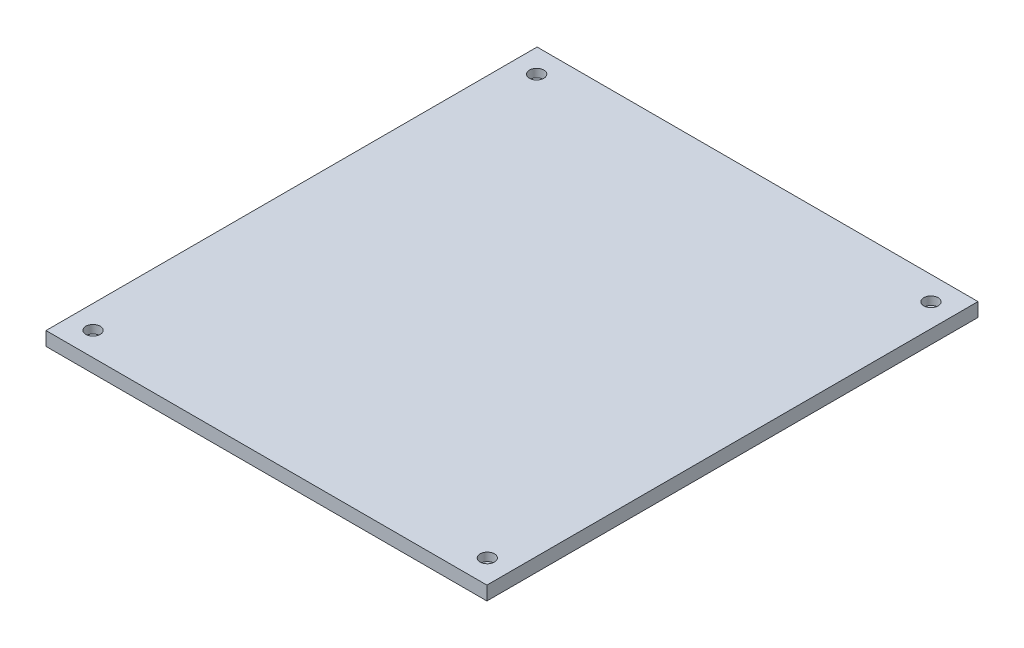
from build123d import *

# Parameters (mm, degrees)
SKETCH1_W           = 160
SKETCH1_H           = 178.21
SKETCH1_R           = 1.5
BOSS_EXTRUDE2_DEPTH = 5
SKETCH2_R           = 2.6
CUT_EXTRUDE1_DEPTH  = 3


with BuildPart() as part:
    # Sketch1 → Boss-Extrude2 (new body)
    with BuildSketch(Plane(origin=(0, 0, 0), x_dir=(1, 0, 0), z_dir=(0, 1, 0))):
        Rectangle(SKETCH1_W, SKETCH1_H)
        with Locations(Location((-71.538779571, 80.496682783, 0), (0, 0, 270))):
            Circle(SKETCH1_R, mode=Mode.SUBTRACT)
        with Locations(Location((71.538779571, 80.496682783, 0), (0, 0, 270))):
            Circle(SKETCH1_R, mode=Mode.SUBTRACT)
        with Locations(Location((71.538779571, -80.496682783, 0), (0, 0, 270))):
            Circle(SKETCH1_R, mode=Mode.SUBTRACT)
        with Locations(Location((-71.538779571, -80.496682783, 0), (0, 0, 270))):
            Circle(SKETCH1_R, mode=Mode.SUBTRACT)
    extrude(amount=BOSS_EXTRUDE2_DEPTH)

    # Sketch2 → Cut-Extrude1 (cut)
    with BuildSketch(Plane(origin=(0, 5, 0), x_dir=(1, 0, 0), z_dir=(0, 1, 0))):
        with Locations(Location((-71.538779571, 80.496682783, 0), (0, 0, 270))):
            Circle(SKETCH2_R)
        with Locations(Location((71.538779571, 80.496682783, 0), (0, 0, 90))):
            Circle(SKETCH2_R)
        with Locations(Location((71.538779571, -80.496682783, 0), (0, 0, 270))):
            Circle(SKETCH2_R)
        with Locations(Location((-71.538779571, -80.496682783, 0), (0, 0, 90))):
            Circle(SKETCH2_R)
    extrude(amount=-CUT_EXTRUDE1_DEPTH, mode=Mode.SUBTRACT)


solid = part.part
